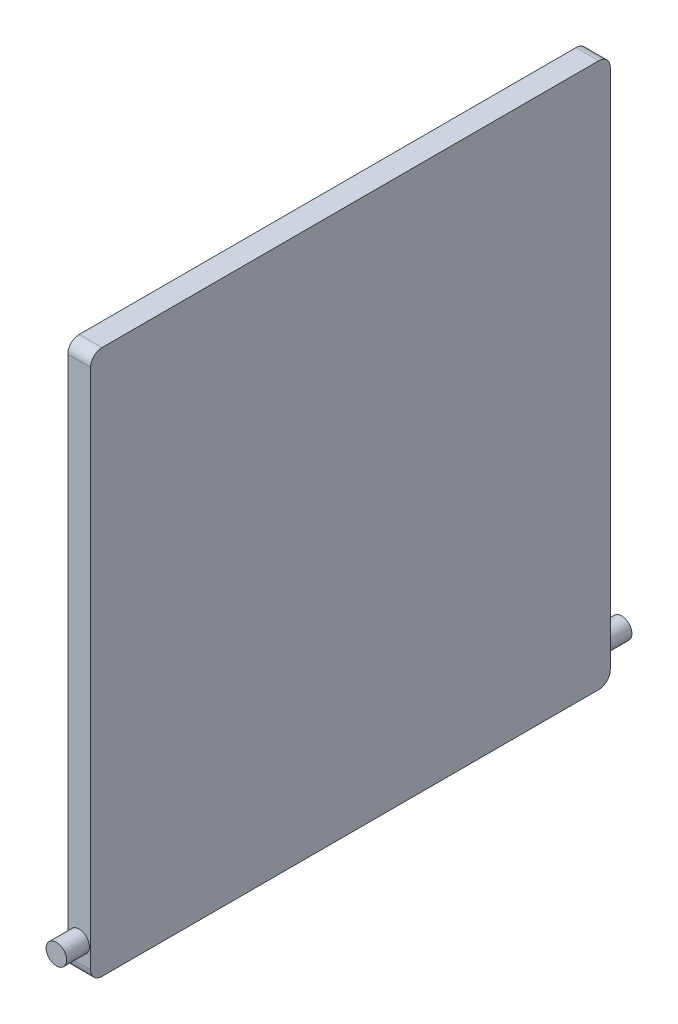
from build123d import *

# Parameters (mm, degrees)
SKETCH1_W           = 228
SKETCH1_H           = 238.91999995
BOSS_EXTRUDE1_DEPTH = 10
SKETCH2_R           = 4.5
BOSS_EXTRUDE2_DEPTH = 10
FILLET1_R           = 5


with BuildPart() as part:
    # Sketch1 → Boss-Extrude1 (new body)
    with BuildSketch(Plane(origin=(0, 0, 0), x_dir=(0, 0, -1), z_dir=(1, 0, 0))):
        with Locations((0, 119.459999975)):
            Rectangle(SKETCH1_W, SKETCH1_H)
    extrude(amount=-BOSS_EXTRUDE1_DEPTH)

    # Sketch2 → Boss-Extrude2 (add)
    with BuildSketch(Plane(origin=(0, 0, -114), x_dir=(-1, 0, 0), z_dir=(0, 0, -1))):
        with Locations((5, 13.5)):
            Circle(SKETCH2_R)
    boss_extrude2 = extrude(amount=BOSS_EXTRUDE2_DEPTH)

    # Mirror1: Boss-Extrude2 across plane
    add(boss_extrude2.mirror(Plane.XY))

    # Fillet1
    fillet1_edges = [part.edges().sort_by_distance(p)[0] for p in [
        (-5, 238.91999995, 114),
        (-5, 238.91999995, -114),
        (-5, 0, -114),
        (-5, 0, 114),
    ]]
    fillet(fillet1_edges, radius=FILLET1_R)


solid = part.part
